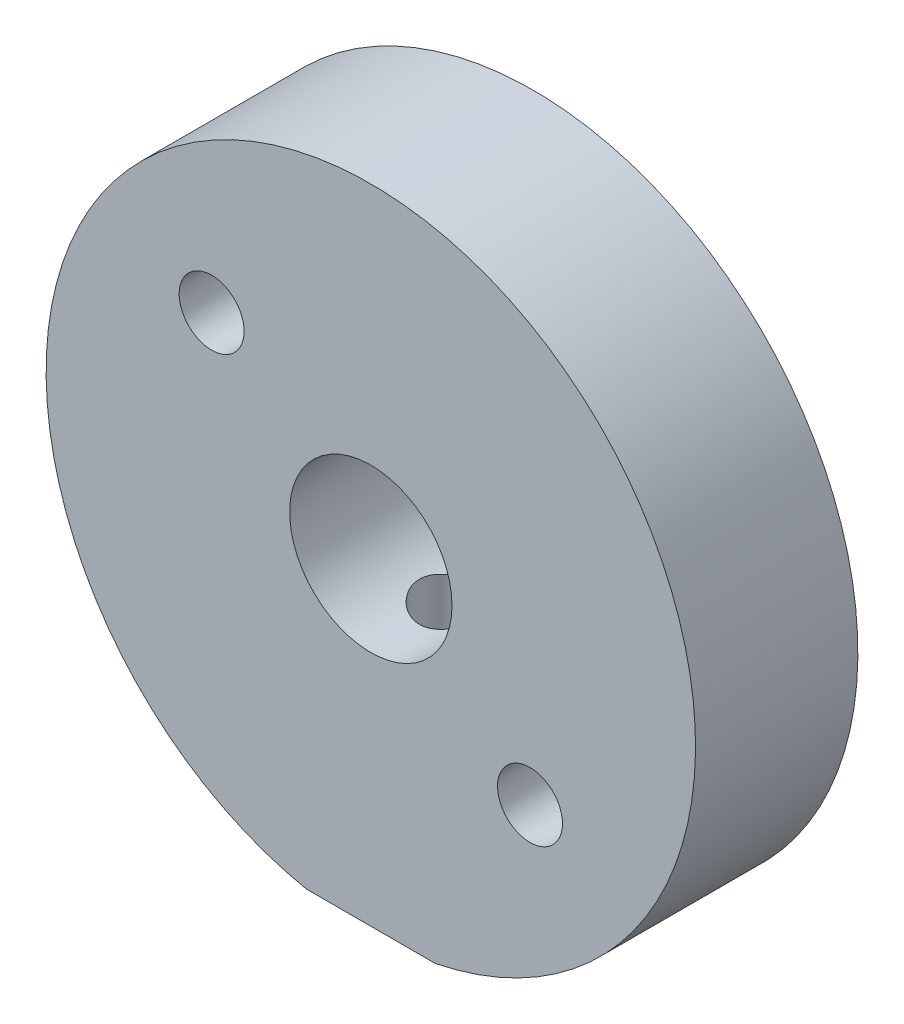
from build123d import *

# Parameters (mm, degrees)
SKETCH1_R           = 5
SKETCH1_R_2         = 1.25
EXTRUDE1_DEPTH      = 1.25
EXTRUDE2_DEPTH      = 8.180703308
EXTRUDE2_DEPTH_BACK = 8.180703308
SKETCH2_R           = 0.5
SKETCH3_R           = 0.5
EXTRUDE3_DEPTH      = 8.180703308
EXTRUDE4_DEPTH      = 8.180703465
EXTRUDE4_DEPTH_BACK = 8.180703465
SKETCH4_W           = 4.205463009
SKETCH4_H           = 0.572765835
SKETCH4_W_2         = 4.092184544


with BuildPart() as part:
    # Sketch1 → Extrude1 (new, symmetric)
    with BuildSketch(Plane.XY):
        Circle(SKETCH1_R)
        Circle(SKETCH1_R_2, mode=Mode.SUBTRACT)
    extrude(amount=EXTRUDE1_DEPTH, both=True)

    # Sketch2 → Extrude2 (cut, two sides: drawn at the far end of the back side and taken through both)
    with BuildSketch(Plane.XY.offset(-EXTRUDE2_DEPTH_BACK)):
        with Locations((-2.451342218, 2.056920351)):
            Circle(SKETCH2_R)
        with Locations((2.451342218, -2.056920351)):
            Circle(SKETCH2_R)
    extrude(amount=EXTRUDE2_DEPTH + EXTRUDE2_DEPTH_BACK, mode=Mode.SUBTRACT)

    # Sketch3 → Extrude3 (cut, through all)
    with BuildSketch(Plane(origin=(0, 0, 0), x_dir=(1, 0, 0), z_dir=(0, 1, 0))):
        with Locations(Location((0, 0, 0), (0, 0, 270))):
            Circle(SKETCH3_R)
    extrude(amount=-EXTRUDE3_DEPTH, mode=Mode.SUBTRACT)

    # Sketch4 → Extrude4 (cut, two sides: drawn at the far end of the back side and taken through both)
    with BuildSketch(Plane.XY.offset(-EXTRUDE4_DEPTH_BACK)):
        with Locations((-2.102731505, -5.186382918)):
            Rectangle(SKETCH4_W, SKETCH4_H)
        with Locations((2.046092272, -5.186382918)):
            Rectangle(SKETCH4_W_2, SKETCH4_H)
    extrude(amount=EXTRUDE4_DEPTH + EXTRUDE4_DEPTH_BACK, mode=Mode.SUBTRACT)


solid = part.part
